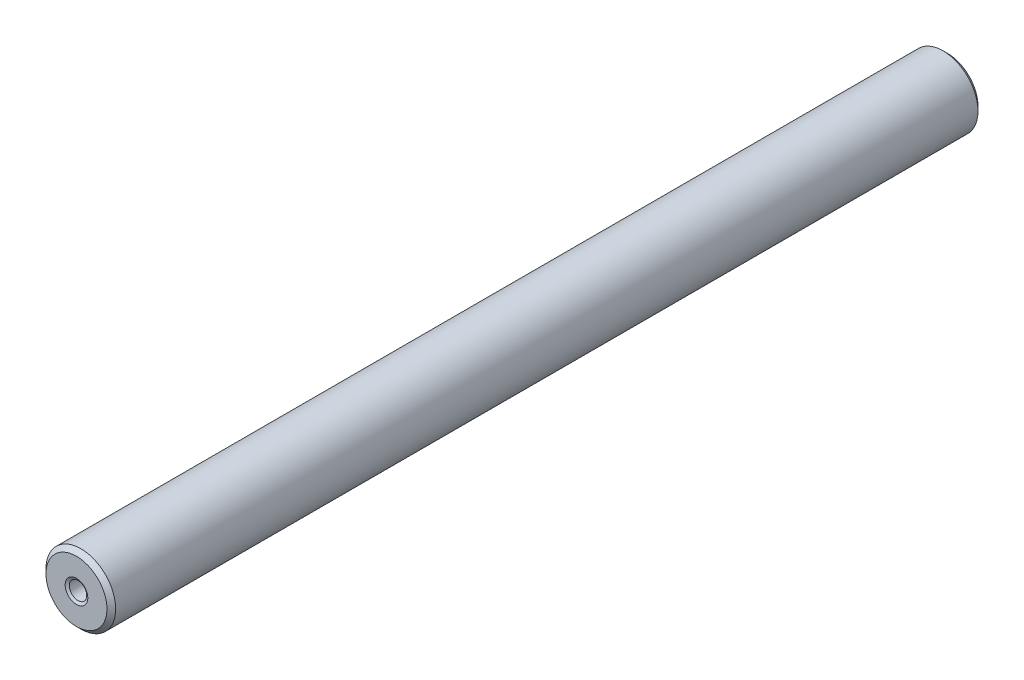
from build123d import *
from OCP.BRepFilletAPI import BRepFilletAPI_MakeChamfer

# Parameters (mm, degrees)
CHAMFER1_SIZE  = 0.5
CHAMFER2_SIZE  = 0.3
CHAMFER2_SIZE2 = 0.173205081


with BuildPart() as part:
    # Sketch1 → Revolve1 (revolve)
    with BuildSketch(Plane(origin=(0, 0, 0), x_dir=(1, 0, 0), z_dir=(0, 1, 0)), mode=Mode.PRIVATE) as revolve1_sk:
        Polygon((-1, 0), (-4, 0), (-4, -100), (-1, -100), (-1, -98), (0, -98), (0, -2), (-1, -2), align=None)
    revolve(revolve1_sk.sketch.rotate(Axis((0, 0, 98), (0, 0, -1)), 180), axis=Axis((0, 0, 98), (0, 0, -1)))

    # Chamfer1
    chamfer1_edges = [part.edges().sort_by_distance(p)[0] for p in [
        (-4, 0, 100),
        (-4, 0, 0),
    ]]
    chamfer(chamfer1_edges, length=CHAMFER1_SIZE)

    # Chamfer2: one chamfer whose edges measure the first distance from different faces: ONE call of the kernel's chamfer builder (chamfer() names one face for all edges)
    chamfer2_edges_1 = [part.edges().sort_by_distance(p)[0] for p in [
        (-1, 0, 2),
    ]]
    chamfer2_side_1 = [part.faces().sort_by_distance(p)[0] for p in [
        (0, 0, 2),
    ]]
    chamfer2_edges_2 = [part.edges().sort_by_distance(p)[0] for p in [
        (-1, 0, 98),
    ]]
    chamfer2_side_2 = [part.faces().sort_by_distance(p)[0] for p in [
        (-1, 0, 99),
    ]]
    chamfer2_edges_3 = [part.edges().sort_by_distance(p)[0] for p in [
        (-1, 0, 100),
    ]]
    chamfer2_side_3 = [part.faces().sort_by_distance(p)[0] for p in [
        (-3.401005051, 0, 100),
    ]]
    chamfer2_edges_4 = [part.edges().sort_by_distance(p)[0] for p in [
        (-1, 0, 0),
    ]]
    chamfer2_side_4 = [part.faces().sort_by_distance(p)[0] for p in [
        (-1, 0, 1),
    ]]
    chamfer2 = BRepFilletAPI_MakeChamfer(part.part.solid().wrapped)
    for e in chamfer2_edges_1:
        chamfer2.Add(CHAMFER2_SIZE, CHAMFER2_SIZE2, e.wrapped, chamfer2_side_1[0].wrapped)  # the first distance lies on this face
    for e in chamfer2_edges_2:
        chamfer2.Add(CHAMFER2_SIZE, CHAMFER2_SIZE2, e.wrapped, chamfer2_side_2[0].wrapped)  # the first distance lies on this face
    for e in chamfer2_edges_3:
        chamfer2.Add(CHAMFER2_SIZE, CHAMFER2_SIZE2, e.wrapped, chamfer2_side_3[0].wrapped)  # the first distance lies on this face
    for e in chamfer2_edges_4:
        chamfer2.Add(CHAMFER2_SIZE, CHAMFER2_SIZE2, e.wrapped, chamfer2_side_4[0].wrapped)  # the first distance lies on this face
    add(Compound.cast(chamfer2.Shape()), mode=Mode.REPLACE)


solid = part.part
